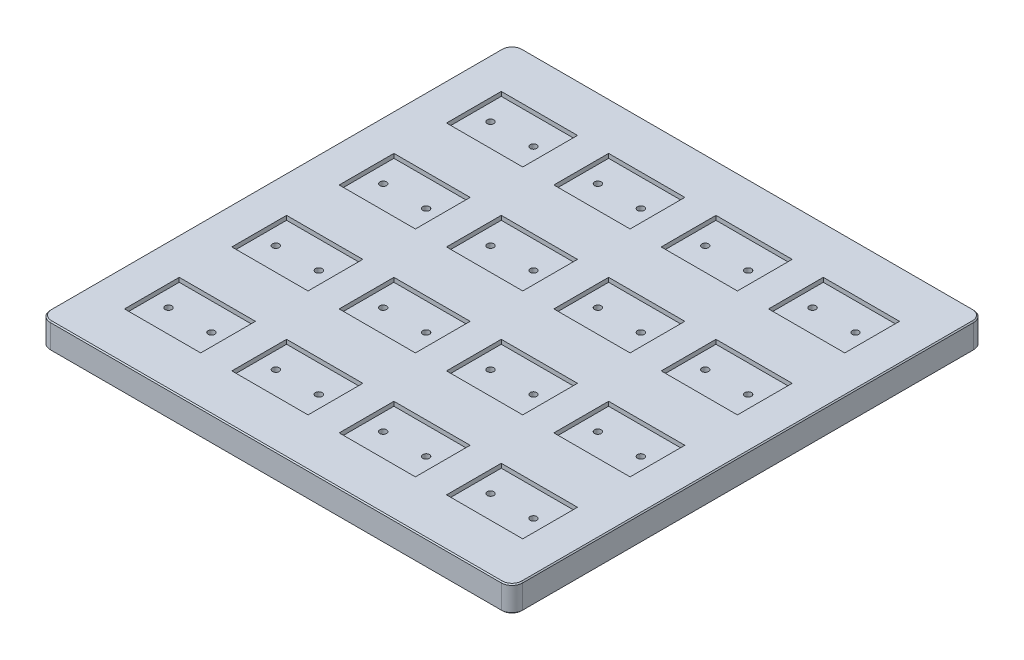
from build123d import *

# Parameters (mm, degrees)
SKETCH1_W            = 220
SKETCH1_H            = 220
BOSS_EXTRUDE1_DEPTH  = 12
SKETCH2_W            = 35.5
SKETCH2_H            = 25.5
CUT_EXTRUDE1_DEPTH   = 2
LPATTERN1_COUNT      = 4
LPATTERN1_PITCH      = 50
LPATTERN1_COUNT_DIR2 = 4
LPATTERN1_PITCH_DIR2 = 50
SKETCH3_R            = 1.55
CUT_EXTRUDE2_DEPTH   = 312.287648325
LPATTERN2_COUNT      = 4
LPATTERN2_PITCH      = 50
LPATTERN2_COUNT_DIR2 = 4
LPATTERN2_PITCH_DIR2 = 50
SKETCH4_W            = 200
SKETCH4_H            = 200
CUT_EXTRUDE3_DEPTH   = 3
FILLET1_R            = 5
CHAMFER1_SIZE        = 0.5


with BuildPart() as part:
    # Sketch1 → Boss-Extrude1 (new body)
    with BuildSketch(Plane(origin=(0, 0, 0), x_dir=(1, 0, 0), z_dir=(0, 1, 0))):
        with Locations((110, 110)):
            Rectangle(SKETCH1_W, SKETCH1_H)
    extrude(amount=BOSS_EXTRUDE1_DEPTH)

    # Sketch2 → Cut-Extrude1 (cut)
    with BuildSketch(Plane(origin=(0, 12, 0), x_dir=(1, 0, 0), z_dir=(0, 1, 0))):
        with Locations((35, 35)):
            Rectangle(SKETCH2_W, SKETCH2_H)
    cut_extrude1 = extrude(amount=-CUT_EXTRUDE1_DEPTH, mode=Mode.SUBTRACT)

    # LPattern1: Cut-Extrude1 4 × 4
    with Locations(*[(j * LPATTERN1_PITCH_DIR2, 0, -i * LPATTERN1_PITCH) for i in range(LPATTERN1_COUNT) for j in range(LPATTERN1_COUNT_DIR2) if (i, j) != (0, 0)]):
        add(cut_extrude1, mode=Mode.SUBTRACT)

    # Sketch3 → Cut-Extrude2 (cut, through all)
    with BuildSketch(Plane(origin=(0, 10, 0), x_dir=(1, 0, 0), z_dir=(0, 1, 0))):
        with Locations(Location((25, 35, 0), (0, 0, 270))):
            Circle(SKETCH3_R)
        with Locations(Location((45, 35, 0), (0, 0, 270))):
            Circle(SKETCH3_R)
    cut_extrude2 = extrude(amount=-CUT_EXTRUDE2_DEPTH, mode=Mode.SUBTRACT)

    # LPattern2: Cut-Extrude2 4 × 4
    with Locations(*[(j * LPATTERN2_PITCH_DIR2, 0, -i * LPATTERN2_PITCH) for i in range(LPATTERN2_COUNT) for j in range(LPATTERN2_COUNT_DIR2) if (i, j) != (0, 0)]):
        add(cut_extrude2, mode=Mode.SUBTRACT)

    # Sketch4 → Cut-Extrude3 (cut)
    with BuildSketch(Plane.XZ):
        with Locations((110, -110)):
            Rectangle(SKETCH4_W, SKETCH4_H)
    extrude(amount=-CUT_EXTRUDE3_DEPTH, mode=Mode.SUBTRACT)

    # Fillet1
    fillet1_edges = [part.edges().sort_by_distance(p)[0] for p in [
        (0, 6, -220),
        (220, 6, -220),
        (220, 6, 0),
        (0, 6, 0),
    ]]
    fillet(fillet1_edges, radius=FILLET1_R)

    # Chamfer1
    chamfer1_edges = [part.edges().sort_by_distance(p)[0] for p in [
        (0, 0, -110),
        (0, 12, -110),
        (110, 0, -220),
        (220, 0, -110),
        (110, 0, 0),
        (218.535533906, 0, -218.535533906),
        (218.535533906, 0, -1.464466094),
        (1.464466094, 0, -1.464466094),
        (1.464466094, 0, -218.535533906),
        (110, 12, -220),
        (110, 12, 0),
        (220, 12, -110),
        (218.535533906, 12, -218.535533906),
        (218.535533906, 12, -1.464466094),
        (1.464466094, 12, -1.464466094),
        (1.464466094, 12, -218.535533906),
    ]]
    chamfer(chamfer1_edges, length=CHAMFER1_SIZE)


solid = part.part
